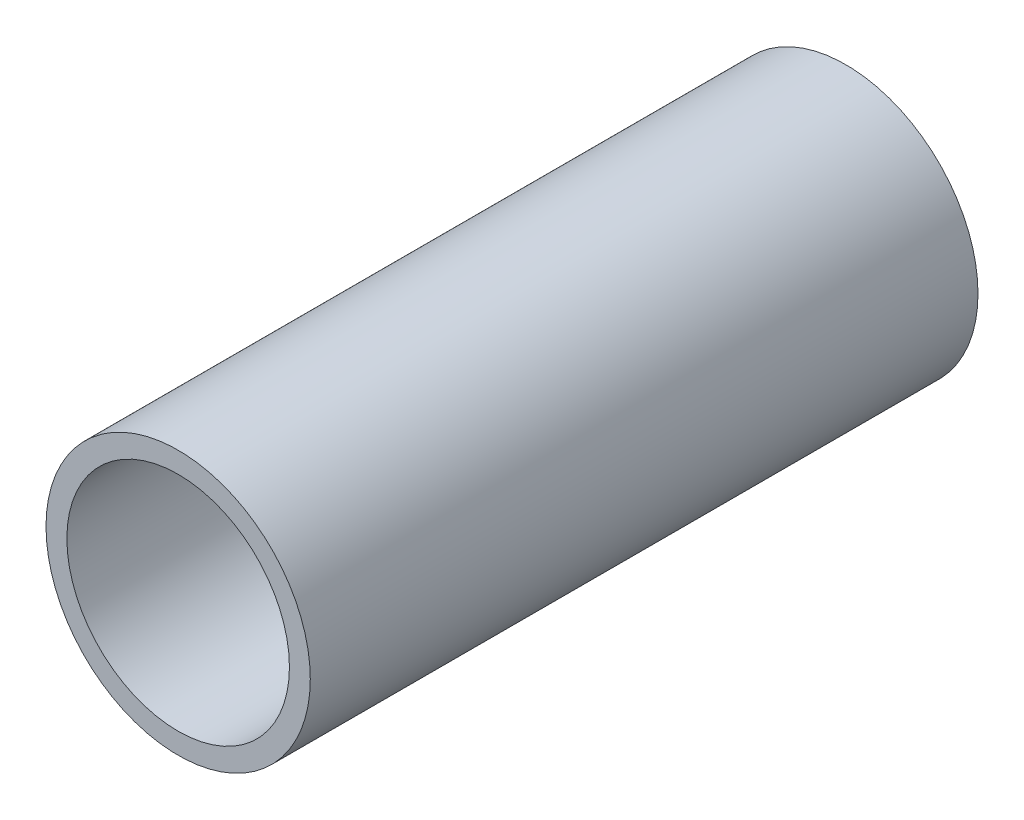
from build123d import *

# Parameters (mm, degrees)
SKETCH2_R           = 31.6665
SKETCH2_R_2         = 26.6665
BOSS_EXTRUDE1_DEPTH = 160


with BuildPart() as part:
    # Sketch2 → Boss-Extrude1 (new body)
    with BuildSketch(Plane.XY):
        Circle(SKETCH2_R)
        Circle(SKETCH2_R_2, mode=Mode.SUBTRACT)
    extrude(amount=BOSS_EXTRUDE1_DEPTH)


solid = part.part
